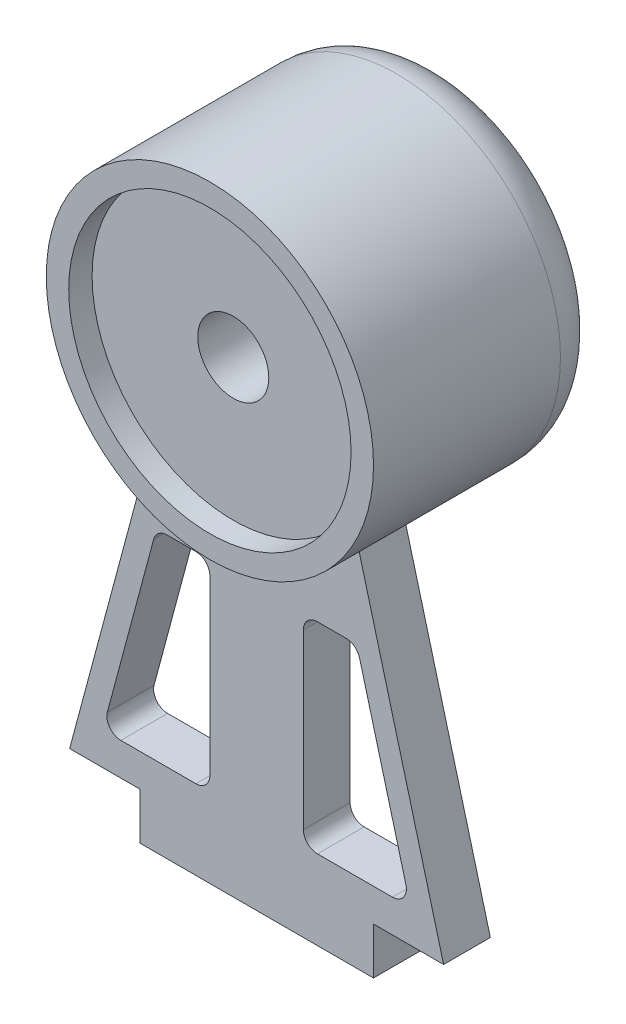
from build123d import *

# Parameters (mm, degrees)
BOSS_EXTRUDE1_DEPTH = 3.175
CUT_EXTRUDE1_DEPTH  = 6.35


with BuildPart() as part:
    # Sketch2 → Boss-Extrude1 (new, symmetric)
    with BuildSketch(Plane.XY):
        Polygon((-9.235964967, 0), (9.235964967, 0), (25.4, -60.325), (15.875, -60.325), (15.875, -66.675), (-15.875, -66.675), (-15.875, -60.325), (-25.4, -60.325), align=None)
    extrude(amount=BOSS_EXTRUDE1_DEPTH, both=True)

    # Sketch3 → Revolve1 (revolve)
    with BuildSketch(Plane(origin=(0, 0, 0), x_dir=(0, 0, -1), z_dir=(1, 0, 0)), mode=Mode.PRIVATE) as revolve1_sk:
        with BuildLine():
            Line((22.225, 0), (22.225, 15.875))
            ThreePointArc((22.225, 15.875), (20.365128061, 20.365128061), (15.875, 22.225))
            Line((15.875, 22.225), (-9.525, 22.225))
            Line((-9.525, 22.225), (-9.525, 0))
            Line((-9.525, 0), (0, 0))
            Line((0, 0), (22.225, 0))
        make_face()
    revolve(revolve1_sk.sketch.rotate(Axis((0, 0, 0), (0, 0, -1)), 90), axis=Axis((0, 0, 0), (0, 0, -1)))

    # Sketch5 → Cut-Revolve1 (revolve, cut)
    with BuildSketch(Plane(origin=(0, 0, 0), x_dir=(0, 0, -1), z_dir=(1, 0, 0)), mode=Mode.PRIVATE) as cut_revolve1_sk:
        Polygon((-9.525, 19.177), (-6.35, 19.177), (-6.35, 4.826), (12.954, 4.826), (12.954, 0), (-9.525, 0), align=None)
    revolve(cut_revolve1_sk.sketch.rotate(Axis((0, 0, 9.525), (0, 0, -1)), 90), axis=Axis((0, 0, 9.525), (0, 0, -1)), mode=Mode.SUBTRACT)

    # Sketch6 → Cut-Extrude1 (cut)
    with BuildSketch(Plane(origin=(0, 0, -3.175), x_dir=(-1, 0, 0), z_dir=(0, 0, -1))):
        with BuildLine():
            Line((-13.983942054, -29.986949719), (-20.279408331, -53.481949719))
            ThreePointArc((-20.279408331, -53.481949719), (-19.950657745, -55.134690522), (-18.439319632, -55.88))
            Line((-18.439319632, -55.88), (-8.255, -55.88))
            ThreePointArc((-8.255, -55.88), (-6.907961582, -55.322038418), (-6.35, -53.975))
            Line((-6.35, -53.975), (-6.35, -30.48))
            ThreePointArc((-6.35, -30.48), (-6.907961582, -29.132961582), (-8.255, -28.575))
            Line((-8.255, -28.575), (-12.143853355, -28.575))
            ThreePointArc((-12.143853355, -28.575), (-13.303543878, -28.968661887), (-13.983942054, -29.986949719))
        make_face()
        with BuildLine():
            Line((8.255, -28.575), (12.143853355, -28.575))
            ThreePointArc((12.143853355, -28.575), (13.303543878, -28.968661887), (13.983942054, -29.986949719))
            Line((13.983942054, -29.986949719), (20.279408331, -53.481949719))
            ThreePointArc((20.279408331, -53.481949719), (19.950657745, -55.134690522), (18.439319632, -55.88))
            Line((18.439319632, -55.88), (8.255, -55.88))
            ThreePointArc((8.255, -55.88), (6.907961582, -55.322038418), (6.35, -53.975))
            Line((6.35, -53.975), (6.35, -30.48))
            ThreePointArc((6.35, -30.48), (6.907961582, -29.132961582), (8.255, -28.575))
        make_face()
    extrude(amount=-CUT_EXTRUDE1_DEPTH, mode=Mode.SUBTRACT)


solid = part.part
